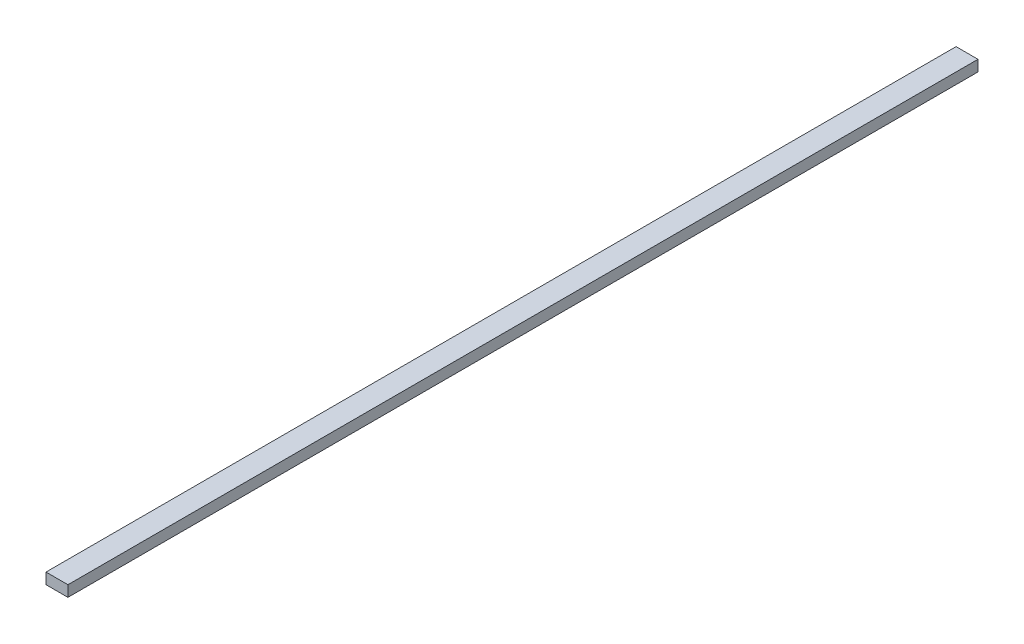
from build123d import *

# Parameters (mm, degrees)
SKETCH1_W           = 12.7
SKETCH1_H           = 6.35
BOSS_EXTRUDE1_DEPTH = 527.05


with BuildPart() as part:
    # Sketch1 → Boss-Extrude1 (new body)
    with BuildSketch(Plane.XY):
        Rectangle(SKETCH1_W, SKETCH1_H)
    extrude(amount=BOSS_EXTRUDE1_DEPTH)


solid = part.part
